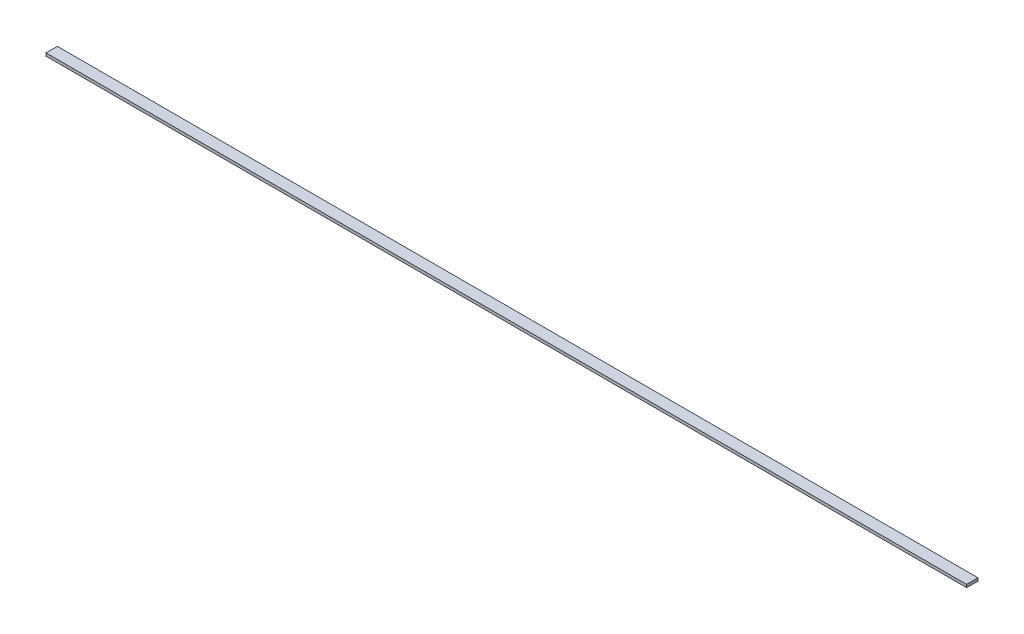
from build123d import *

# Parameters (mm, degrees)
CROQUIS1_W              = 485
CROQUIS1_H              = 6
SALIENTE_EXTRUIR1_DEPTH = 1.5


with BuildPart() as part:
    # Croquis1 → Saliente-Extruir1 (new body)
    with BuildSketch(Plane(origin=(0, 0, 0), x_dir=(1, 0, 0), z_dir=(0, 1, 0))):
        with Locations((242.5, -3)):
            Rectangle(CROQUIS1_W, CROQUIS1_H)
    extrude(amount=SALIENTE_EXTRUIR1_DEPTH)


solid = part.part
